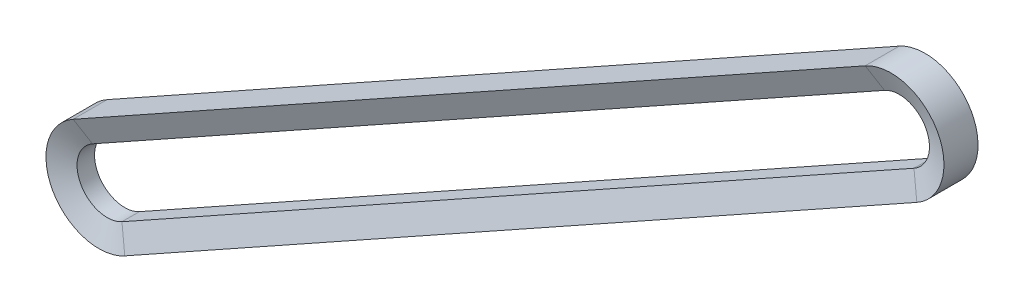
from build123d import *


with BuildPart() as part:
    # 扫描1: sweep along a path in 草图2
    with BuildLine(Plane.XY) as sweep_1_path:
        Line((2.584252226, -4.627271381), (-136.48462728, -82.294871103))
        ThreePointArc((-136.48462728, -82.294871103), (-143.696150887, -80.251851948), (-141.653131732, -73.040328341))
        Line((-141.653131732, -73.040328341), (-2.584252226, 4.627271381))
        ThreePointArc((-2.584252226, 4.627271381), (4.627271381, 2.584252226), (2.584252226, -4.627271381))
    # 草图3 → 扫描1 (sweep)
    with BuildSketch(Plane(origin=(0, 0, 0), x_dir=(0, 0, -1), z_dir=(0.8730700718740267, 0.48759475960871657, 0))):
        Polygon((-1.535, 5.3), (1.535, 5.3), (2.990880937, 9.3), (-2.990880937, 9.3), align=None)
    sweep(path=sweep_1_path.line)


solid = part.part
